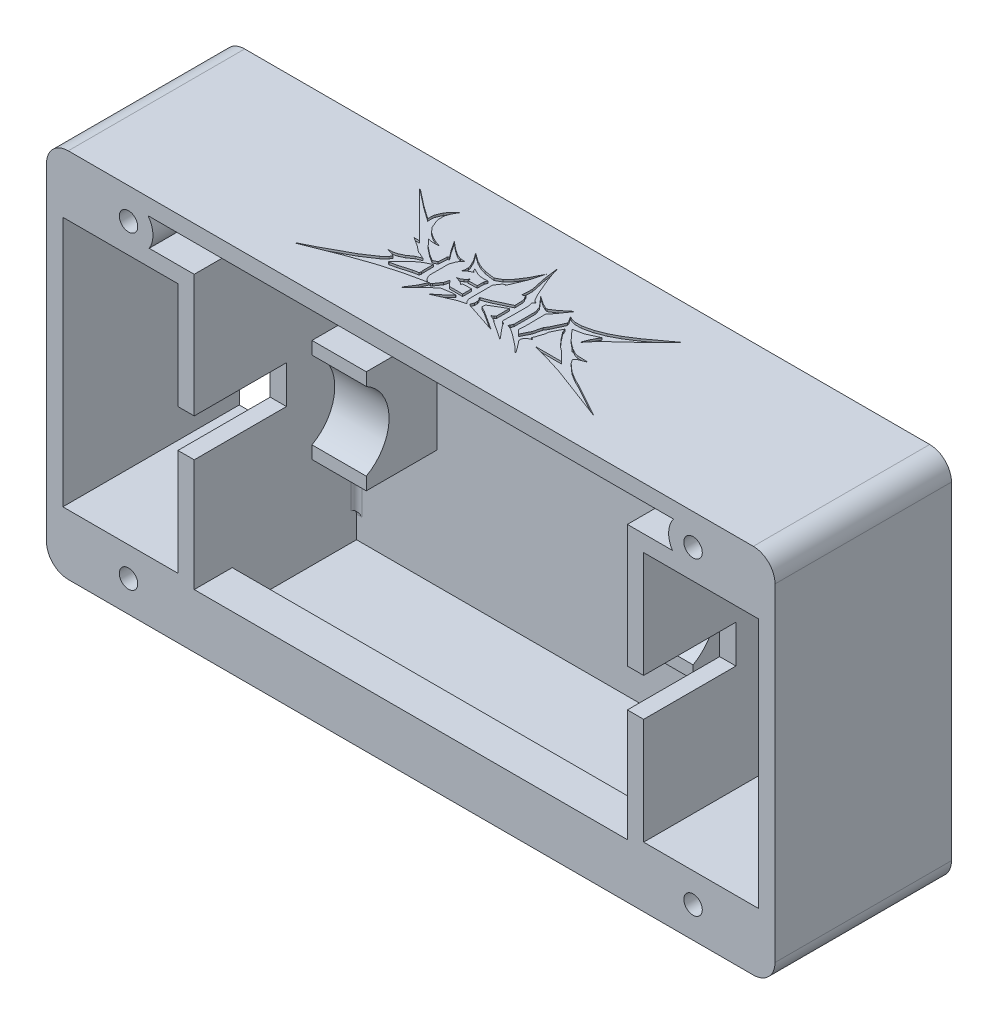
from build123d import *

# Parameters (mm, degrees)
BASE_FOOTPRINT_W                   = 134.2
BASE_FOOTPRINT_H                   = 68.4
UNBROKEN_FLOOR_DEPTH               = 2.6
SHELL_PROFILE_W                    = 134.2
SHELL_PROFILE_H                    = 68.4
SHELL_PROFILE_W_2                  = 128.2
SHELL_PROFILE_H_2                  = 62.4
THREE_MM_PERIMETER_DEPTH           = 32.5
OPEN_WHEEL_WELLS_START             = 36
WHEEL_WELL_PROFILE_W               = 21.2
WHEEL_WELL_PROFILE_H               = 46.2
OPEN_WHEEL_WELLS_DEPTH             = 38
WHEEL_GUARD_PROFILE_W              = 3
WHEEL_GUARD_PROFILE_H              = 46.2
INNER_WHEEL_GUARDS_DEPTH           = 32.5
WHEEL_RETURN_PROFILE_W             = 24.2
WHEEL_RETURN_PROFILE_H             = 3
WHEEL_RETURN_RIBS_DEPTH            = 32.5
OPEN_SHAFT_NOTCHES_START           = 32.5
SHAFT_DROP_IN_PROFILE_W            = 3.7
SHAFT_DROP_IN_PROFILE_H            = 7
OPEN_SHAFT_NOTCHES_DEPTH           = 17
LOWER_CRADLE_BLOCKS_PROFILE_W      = 10
LOWER_CRADLE_BLOCKS_PROFILE_H      = 19
LOWER_MOTOR_CRADLES_DEPTH          = 15.6
LOWER_CRADLE_SEATS_R8P2_START      = 36
LOWER_CRADLE_RADIUS_PROFILE_R      = 8.2
LOWER_CRADLE_SEATS_R8P2_DEPTH      = 72
BATTERY_SIDE_GUIDES_PROFILE_W      = 3
BATTERY_SIDE_GUIDES_PROFILE_H      = 21.2
BATTERY_SIDE_GUIDES_DEPTH          = 5.6
LID_SCREW_BOSS_PROFILE_R           = 4.5
REINFORCED_M3_BOSSES_DEPTH         = 32.5
M3_THROUGH_HOLES_START             = 35.5
M3_THROUGH_HOLES_PROFILE_R         = 1.7
M3_THROUGH_HOLES_DEPTH             = 36
M3_HEX_NUT_POCKETS_UNDERSIDE_START = 2.6
M3_HEX_NUT_POCKETS_UNDERSIDE_DEPTH = 2.7
OUTER_CORNERS_R4_R                 = 4
INNER_CORNERS_R1_R                 = 1
WHEEL_RETURN_ROOT_FILLETS_R1_R     = 1
VIPER_REAR_ENGRAVED_START          = 34.2
VIPER_REAR_ENGRAVED_DEPTH          = 0.4
SKETCH1_W                          = 8.5
SKETCH1_H                          = 5.1
BOSS_EXTRUDE1_DEPTH                = 32.5
BOSS_EXTRUDE2_DEPTH                = 82.5
BOSS_EXTRUDE2_DEPTH_BACK           = 2
SKETCH2_W                          = 7
SKETCH2_H                          = 7
SKETCH3_W                          = 8.5
SKETCH3_H                          = 5.1
BOSS_EXTRUDE5_DEPTH                = 32.5


with BuildPart() as part:
    # Base_Footprint → Unbroken_Floor (new body)
    with BuildSketch(Plane.XY):
        Rectangle(BASE_FOOTPRINT_W, BASE_FOOTPRINT_H)
    extrude(amount=UNBROKEN_FLOOR_DEPTH)

    # Shell_Profile → Three_mm_Perimeter (add)
    with BuildSketch(Plane.XY):
        Rectangle(SHELL_PROFILE_W, SHELL_PROFILE_H)
        Rectangle(SHELL_PROFILE_W_2, SHELL_PROFILE_H_2, mode=Mode.SUBTRACT)
    extrude(amount=THREE_MM_PERIMETER_DEPTH)

    # Wheel_Well_Profile → Open_Wheel_Wells (cut)
    with BuildSketch(Plane.XY.offset(OPEN_WHEEL_WELLS_START)):
        with Locations((53.5, 0)):
            Rectangle(WHEEL_WELL_PROFILE_W, WHEEL_WELL_PROFILE_H)
        with Locations((-53.5, 0)):
            Rectangle(WHEEL_WELL_PROFILE_W, WHEEL_WELL_PROFILE_H)
    extrude(amount=-OPEN_WHEEL_WELLS_DEPTH, mode=Mode.SUBTRACT)

    # Wheel_Guard_Profile → Inner_Wheel_Guards (add)
    with BuildSketch(Plane.XY):
        with Locations((41.4, 0)):
            Rectangle(WHEEL_GUARD_PROFILE_W, WHEEL_GUARD_PROFILE_H)
        with Locations((-41.4, 0)):
            Rectangle(WHEEL_GUARD_PROFILE_W, WHEEL_GUARD_PROFILE_H)
    extrude(amount=INNER_WHEEL_GUARDS_DEPTH)

    # Wheel_Return_Profile → Wheel_Return_Ribs (add)
    with BuildSketch(Plane.XY):
        with Locations((-52, -24.6)):
            Rectangle(WHEEL_RETURN_PROFILE_W, WHEEL_RETURN_PROFILE_H)
        with Locations((-52, 24.6)):
            Rectangle(WHEEL_RETURN_PROFILE_W, WHEEL_RETURN_PROFILE_H)
        with Locations((52, -24.6)):
            Rectangle(WHEEL_RETURN_PROFILE_W, WHEEL_RETURN_PROFILE_H)
        with Locations((52, 24.6)):
            Rectangle(WHEEL_RETURN_PROFILE_W, WHEEL_RETURN_PROFILE_H)
    extrude(amount=WHEEL_RETURN_RIBS_DEPTH)

    # Shaft_Drop_In_Profile → Open_Shaft_Notches (cut)
    with BuildSketch(Plane.XY.offset(OPEN_SHAFT_NOTCHES_START)):
        with Locations((-41.35, 0)):
            Rectangle(SHAFT_DROP_IN_PROFILE_W, SHAFT_DROP_IN_PROFILE_H)
        with Locations((41.35, 0)):
            Rectangle(SHAFT_DROP_IN_PROFILE_W, SHAFT_DROP_IN_PROFILE_H)
    extrude(amount=-OPEN_SHAFT_NOTCHES_DEPTH, mode=Mode.SUBTRACT)

    # Lower_Cradle_Blocks_Profile → Lower_Motor_Cradles (add)
    with BuildSketch(Plane.XY):
        with Locations((-30.1, 0)):
            Rectangle(LOWER_CRADLE_BLOCKS_PROFILE_W, LOWER_CRADLE_BLOCKS_PROFILE_H)
        with Locations((30.1, 0)):
            Rectangle(LOWER_CRADLE_BLOCKS_PROFILE_W, LOWER_CRADLE_BLOCKS_PROFILE_H)
    extrude(amount=LOWER_MOTOR_CRADLES_DEPTH)

    # Lower_Cradle_Radius_Profile → Lower_Cradle_Seats_R8p2 (cut)
    with BuildSketch(Plane(origin=(0, 0, 0), x_dir=(0, 0, -1), z_dir=(1, 0, 0)).offset(LOWER_CRADLE_SEATS_R8P2_START)):
        with Locations((-19.6, 0)):
            Circle(LOWER_CRADLE_RADIUS_PROFILE_R)
    extrude(amount=-LOWER_CRADLE_SEATS_R8P2_DEPTH, mode=Mode.SUBTRACT)

    # Battery_Side_Guides_Profile → Battery_Side_Guides (add)
    with BuildSketch(Plane.XY):
        with Locations((-30, 20.6)):
            Rectangle(BATTERY_SIDE_GUIDES_PROFILE_W, BATTERY_SIDE_GUIDES_PROFILE_H)
        with Locations((30, 20.6)):
            Rectangle(BATTERY_SIDE_GUIDES_PROFILE_W, BATTERY_SIDE_GUIDES_PROFILE_H)
    extrude(amount=BATTERY_SIDE_GUIDES_DEPTH)

    # Lid_Screw_Boss_Profile → Reinforced_M3_Bosses (add)
    with BuildSketch(Plane.XY):
        with Locations((-52, -28.5)):
            Circle(LID_SCREW_BOSS_PROFILE_R)
        with Locations((-52, 28.5)):
            Circle(LID_SCREW_BOSS_PROFILE_R)
        with Locations((52, -28.5)):
            Circle(LID_SCREW_BOSS_PROFILE_R)
        with Locations((52, 28.5)):
            Circle(LID_SCREW_BOSS_PROFILE_R)
    extrude(amount=REINFORCED_M3_BOSSES_DEPTH)

    # M3_Through_Holes_Profile → M3_Through_Holes (cut)
    with BuildSketch(Plane.XY.offset(M3_THROUGH_HOLES_START)):
        with Locations(Location((-52, -28.5, 0), (0, 0, 180))):
            Circle(M3_THROUGH_HOLES_PROFILE_R)
        with Locations(Location((-52, 28.5, 0), (0, 0, 180))):
            Circle(M3_THROUGH_HOLES_PROFILE_R)
        with Locations(Location((52, -28.5, 0), (0, 0, 180))):
            Circle(M3_THROUGH_HOLES_PROFILE_R)
        with Locations(Location((52, 28.5, 0), (0, 0, 180))):
            Circle(M3_THROUGH_HOLES_PROFILE_R)
    extrude(amount=-M3_THROUGH_HOLES_DEPTH, mode=Mode.SUBTRACT)

    # Captive_Nut_Pockets_Profile → M3_Hex_Nut_Pockets_Underside (cut)
    with BuildSketch(Plane.XY.offset(M3_HEX_NUT_POCKETS_UNDERSIDE_START)):
        Polygon((-48.709103466, -28.5), (-50.354551733, -25.65), (-53.645448267, -25.65), (-55.290896534, -28.5), (-53.645448267, -31.35), (-50.354551733, -31.35), align=None)
        Polygon((-48.709103466, 28.5), (-50.354551733, 31.35), (-53.645448267, 31.35), (-55.290896534, 28.5), (-53.645448267, 25.65), (-50.354551733, 25.65), align=None)
        Polygon((55.290896534, -28.5), (53.645448267, -25.65), (50.354551733, -25.65), (48.709103466, -28.5), (50.354551733, -31.35), (53.645448267, -31.35), align=None)
        Polygon((55.290896534, 28.5), (53.645448267, 31.35), (50.354551733, 31.35), (48.709103466, 28.5), (50.354551733, 25.65), (53.645448267, 25.65), align=None)
    extrude(amount=-M3_HEX_NUT_POCKETS_UNDERSIDE_DEPTH, mode=Mode.SUBTRACT)

    # Outer_Corners_R4
    outer_corners_r4_edges = [part.edges().sort_by_distance(p)[0] for p in [
        (-67.1, 34.2, 16.25),
        (67.1, 34.2, 16.25),
        (67.1, -34.2, 16.25),
        (-67.1, -34.2, 16.25),
    ]]
    fillet(outer_corners_r4_edges, radius=OUTER_CORNERS_R4_R)

    # Inner_Corners_R1
    inner_corners_r1_edges = [part.edges().sort_by_distance(p)[0] for p in [
        (-64.1, -31.2, 17.55),
        (64.1, -31.2, 17.55),
        (64.1, 31.2, 17.55),
        (-64.1, 31.2, 17.55),
    ]]
    fillet(inner_corners_r1_edges, radius=INNER_CORNERS_R1_R)

    # Wheel_Return_Root_Fillets_R1
    wheel_return_root_fillets_r1_edges = [part.edges().sort_by_distance(p)[0] for p in [
        (-39.9, 0, 2.6),
        (39.9, 0, 2.6),
        (-44.046713369, 26.1, 2.6),
        (44.046713369, -26.1, 2.6),
        (59.953286631, 26.1, 2.6),
        (-59.953286631, -26.1, 2.6),
        (-59.953286631, 26.1, 2.6),
        (59.953286631, -26.1, 2.6),
        (44.046713369, 26.1, 2.6),
        (-44.046713369, -26.1, 2.6),
    ]]
    fillet(wheel_return_root_fillets_r1_edges, radius=WHEEL_RETURN_ROOT_FILLETS_R1_R)

    # VIPER_Wordmark_Native_Profile → VIPER_Rear_Engraved (cut)
    # profile 1 of 4: a face of its own
    with BuildSketch(Plane(origin=(0, 0, 0), x_dir=(1, 0, 0), z_dir=(0, 1, 0)).offset(VIPER_REAR_ENGRAVED_START)):
        Polygon((27.5, -26.323476703), (17.406810036, -22.538530466), (13.897849462, -21.434587814), (11.335125448, -20.764336918), (11.295698925, -20.685483871), (15.948028674, -20.685483871), (14.213261649, -18.950716846), (13.543010753, -18.477598566), (12.32078853, -17.137096774), (11.374551971, -15.875448029), (11.098566308, -15.165770609), (10.073476703, -17.215949821), (10.073476703, -17.649641577), (9.5609319, -19.226702509), (9.363799283, -19.581541219), (9.797491039, -19.818100358), (9.797491039, -19.896953405), (9.521505376, -19.936379928), (9.08781362, -20.212365591), (8.772401434, -20.527777778), (8.614695341, -20.843189964), (8.654121864, -21.237455197), (9.758064516, -22.656810036), (10.310035842, -23.445340502), (10.270609319, -23.524193548), (9.127240143, -22.459677419), (7.155913978, -20.922043011), (5.97311828, -20.133512545), (5.224014337, -19.857526882), (5.421146953, -19.620967742), (5.61827957, -19.068996416), (5.61827957, -15.244623656), (5.539426523, -14.850358423), (5.224014337, -14.022401434), (3.686379928, -12.248207885), (5.02688172, -13.155017921), (5.97311828, -13.628136201), (6.249103943, -13.667562724), (7.471326165, -12.879032258), (9.32437276, -11.341397849), (7.668458781, -13.706989247), (6.919354839, -14.57437276), (6.958781362, -18.122759857), (6.879928315, -19.581541219), (7.629032258, -20.251792115), (8.456989247, -18.595878136), (8.85125448, -17.018817204), (9.284946237, -16.309139785), (10.349462366, -14.022401434), (10.191756272, -13.588709677), (9.639784946, -12.721326165), (10.231182796, -12.997311828), (10.901433692, -13.155017921), (12.123655914, -13.155017921), (13.976702509, -12.721326165), (15.711469534, -12.051075269), (17.367383513, -11.183691756), (19.535842294, -9.803763441), (24.26702509, -6.334229391), (20.048387097, -10.474014337), (17.406810036, -12.918458781), (15.593189964, -14.732078853), (14.686379928, -15.836021505), (14.646953405, -15.717741935), (15.080645161, -14.613799283), (15.869175627, -13.155017921), (13.621863799, -14.180107527), (11.768817204, -14.57437276), (13.503584229, -16.466845878), (14.410394265, -17.215949821), (14.725806452, -17.373655914), (15.001792115, -17.767921147), (15.120071685, -17.6890681), (15.908602151, -18.122759857), (16.5, -18.28046595), (18.471326165, -18.359318996), (17.209677419, -18.871863799), (16.815412186, -19.147849462), (16.657706093, -19.384408602), (17.130824373, -20.094086022), (18.550179211, -21.355734767), (20.08781362, -22.301971326), (21.310035842, -22.893369176), align=None)
    # profile 2 of 4: a face of its own
    with BuildSketch(Plane(origin=(0, 0, 0), x_dir=(1, 0, 0), z_dir=(0, 1, 0)).offset(VIPER_REAR_ENGRAVED_START)):
        Polygon((-27.421146953, -26.284050179), (-27.5, -26.284050179), (-27.460573477, -26.205197133), (-25.016129032, -24.98297491), (-19.96953405, -22.22311828), (-17.603942652, -20.646057348), (-16.697132616, -19.778673835), (-16.421146953, -19.344982079), (-16.894265233, -19.108422939), (-18.077060932, -18.793010753), (-17.130824373, -18.753584229), (-16.302867384, -18.556451613), (-15.396057348, -18.122759857), (-14.252688172, -17.334229391), (-13.306451613, -16.979390681), (-14.331541219, -16.506272401), (-14.607526882, -16.466845878), (-15.790322581, -15.520609319), (-17.406810036, -14.495519713), (-16.421146953, -14.495519713), (-24.621863799, -6.255376344), (-24.621863799, -6.176523297), (-24.464157706, -6.255376344), (-21.546594982, -8.542114695), (-19.141577061, -10.237455197), (-19.181003584, -9.409498208), (-19.102150538, -8.975806452), (-18.629032258, -7.871863799), (-18.116487455, -7.16218638), (-17.091397849, -6.176523297), (-17.761648746, -7.359318996), (-18.037634409, -8.187275986), (-18.077060932, -9.251792115), (-17.958781362, -9.803763441), (-17.367383513, -11.22311828), (-16.61827957, -12.051075269), (-15.711469534, -12.681899642), (-14.844086022, -13.115591398), (-13.700716846, -13.509856631), (-14.922939068, -13.549283154), (-15.829749104, -13.391577061), (-14.686379928, -14.613799283), (-13.306451613, -15.717741935), (-12.084229391, -16.466845878), (-11.335125448, -16.112007168), (-11.256272401, -14.613799283), (-11.216845878, -14.45609319), (-10.940860215, -14.416666667), (-11.808243728, -13.312724014), (-13.109318996, -11.380824373), (-11.768817204, -12.484767025), (-10.664874552, -13.233870968), (-9.797491039, -13.588709677), (-8.85125448, -13.628136201), (-9.363799283, -14.10125448), (-9.639784946, -14.495519713), (-9.994623656, -15.520609319), (-9.994623656, -19.147849462), (-9.639784946, -19.896953405), (-9.048387097, -20.330645161), (-12.872759857, -21.158602151), (-16.85483871, -22.301971326), (-21.231182796, -23.839605735), align=None)
        Polygon((-15.908602151, -20.685483871), (-15.790322581, -20.724910394), (-14.568100358, -20.448924731), (-12.399641577, -19.818100358), (-11.374551971, -19.620967742), (-11.256272401, -19.305555556), (-11.335125448, -18.911290323), (-11.335125448, -17.018817204), (-12.636200717, -17.649641577), (-13.818996416, -18.51702509), align=None, mode=Mode.SUBTRACT)
    # profile 3 of 4: a face of its own
    with BuildSketch(Plane(origin=(0, 0, 0), x_dir=(1, 0, 0), z_dir=(0, 1, 0)).offset(VIPER_REAR_ENGRAVED_START)):
        Polygon((-10.586021505, -23.563620072), (-10.625448029, -23.484767025), (-9.44265233, -21.63172043), (-8.85125448, -20.291218638), (-8.575268817, -20.291218638), (-8.378136201, -20.133512545), (-7.550179211, -18.911290323), (-7.274193548, -18.004480287), (-6.367383513, -19.029569892), (-3.922939068, -19.029569892), (-3.922939068, -17.373655914), (-5.578853047, -17.413082437), (-5.61827957, -17.767921147), (-5.775985663, -17.531362007), (-6.130824373, -17.294802867), (-7.155913978, -16.979390681), (-6.603942652, -16.821684588), (-6.130824373, -16.545698925), (-5.61827957, -15.993727599), (-5.539426523, -16.387992832), (-3.922939068, -16.348566308), (-3.883512545, -15.086917563), (-3.686379928, -14.613799283), (-4.632616487, -14.653225806), (-5.5, -14.534946237), (-6.801075269, -13.904121864), (-6.603942652, -14.377240143), (-6.367383513, -14.45609319), (-6.367383513, -14.534946237), (-6.958781362, -14.8109319), (-7.707885305, -15.402329749), (-7.589605735, -14.968637993), (-7.589605735, -14.298387097), (-7.786738351, -13.628136201), (-8.338709677, -12.563620072), (-9.245519713, -11.301971326), (-7.707885305, -12.405913978), (-6.682795699, -12.918458781), (-5.460573477, -13.312724014), (-3.607526882, -13.588709677), (-2.543010753, -12.997311828), (-1.55734767, -11.972222222), (-0.413978495, -10.237455197), (0.650537634, -8.068996416), (-0.098566308, -10.710573477), (-1.360215054, -13.706989247), (-1.517921147, -13.588709677), (-1.754480287, -13.706989247), (-2.109318996, -14.10125448), (-2.582437276, -14.889784946), (-2.582437276, -19.226702509), (-2.345878136, -19.778673835), (-1.951612903, -20.172939068), (-3.410394265, -20.567204301), (-7.195340502, -22.22311828), (-5.97311828, -21.27688172), (-4.396057348, -19.857526882), (-4.396057348, -19.778673835), (-5.14516129, -19.818100358), (-6.879928315, -20.094086022), (-8.73297491, -21.671146953), align=None)
    # profile 4 of 4: a face of its own
    with BuildSketch(Plane(origin=(0, 0, 0), x_dir=(1, 0, 0), z_dir=(0, 1, 0)).offset(VIPER_REAR_ENGRAVED_START)):
        Polygon((6.840501792, -22.893369176), (3.252688172, -20.488351254), (3.134408602, -20.330645161), (2.069892473, -19.857526882), (2.503584229, -19.660394265), (2.700716846, -19.423835125), (2.700716846, -17.018817204), (-0.059139785, -18.674731183), (-0.098566308, -19.305555556), (0.887096774, -19.818100358), (4.356630824, -22.065412186), (-1.399641577, -20.172939068), (-1.636200717, -20.015232975), (-1.399641577, -19.344982079), (-1.399641577, -18.793010753), (-1.55734767, -18.359318996), (-1.79390681, -18.083333333), (-1.754480287, -18.004480287), (-0.295698925, -17.452508961), (2.700716846, -16.033154122), (2.661290323, -14.653225806), (2.503584229, -14.061827957), (2.227598566, -13.706989247), (2.188172043, -13.431003584), (1.67562724, -13.746415771), (1.754480287, -11.853942652), (1.123655914, -8.896953405), (0.808243728, -6.413082437), (0.887096774, -6.452508961), (1.044802867, -7.16218638), (1.715053763, -9.015232975), (3.055555556, -12.129928315), (3.686379928, -13.312724014), (4.080645161, -13.628136201), (4.277777778, -13.667562724), (3.883512545, -14.10125448), (4.080645161, -15.008064516), (4.041218638, -19.620967742), (4.238351254, -19.818100358), (4.474910394, -19.896953405), (5.02688172, -20.724910394), align=None)
    extrude(amount=-VIPER_REAR_ENGRAVED_DEPTH, mode=Mode.SUBTRACT)

    # Sketch1 → Boss-Extrude1 (add)
    with BuildSketch(Plane.XY):
        with Locations((-44.15, -28.65)):
            Rectangle(SKETCH1_W, SKETCH1_H)
        with Locations((44.15, -28.65)):
            Rectangle(SKETCH1_W, SKETCH1_H)
    extrude(amount=BOSS_EXTRUDE1_DEPTH)

    # Sketch2 → Boss-Extrude2 (add, two sides: drawn at the far end of the back side and taken through both)
    with BuildSketch(Plane(origin=(-39.9, 0, 0), x_dir=(0, 0, -1), z_dir=(1, 0, 0)).offset(-BOSS_EXTRUDE2_DEPTH_BACK)):
        with Locations((-29, -27.7)):
            Rectangle(SKETCH2_W, SKETCH2_H)
    extrude(amount=BOSS_EXTRUDE2_DEPTH + BOSS_EXTRUDE2_DEPTH_BACK)

    # Sketch3 → Boss-Extrude5 (add)
    with BuildSketch(Plane.XY):
        with Locations((-59.85, 28.65)):
            Rectangle(SKETCH3_W, SKETCH3_H)
        with Locations((-59.85, -28.65)):
            Rectangle(SKETCH3_W, SKETCH3_H)
        with Locations((59.85, -28.65)):
            Rectangle(SKETCH3_W, SKETCH3_H)
        with Locations((59.85, 28.65)):
            Rectangle(SKETCH3_W, SKETCH3_H)
    extrude(amount=BOSS_EXTRUDE5_DEPTH)


solid = part.part
